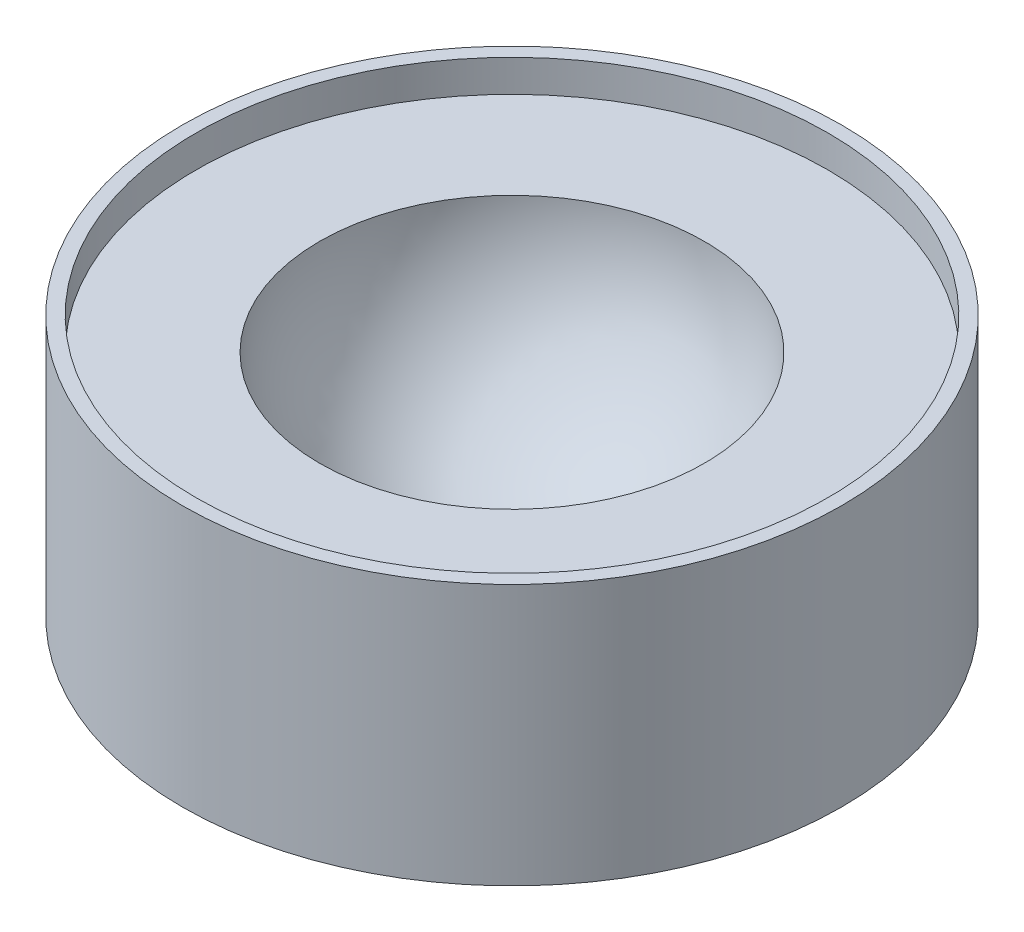
from build123d import *

# Parameters (mm, degrees)
SKETCH1_R           = 72
BOSS_EXTRUDE4_DEPTH = 50
SKETCH5_R           = 72
SKETCH5_R_2         = 69
BOSS_EXTRUDE5_DEPTH = 7


with BuildPart() as part:
    # Sketch1 → Boss-Extrude4 (new body)
    with BuildSketch(Plane(origin=(0, 0, 0), x_dir=(1, 0, 0), z_dir=(0, 1, 0))):
        with Locations(Location((0, 0, 0), (0, 0, 270))):
            Circle(SKETCH1_R)
    extrude(amount=BOSS_EXTRUDE4_DEPTH)

    # Sketch4 → Cut-Revolve2 (revolve, cut)
    with BuildSketch(Plane.XY, mode=Mode.PRIVATE) as cut_revolve2_sk:
        with BuildLine():
            Line((0, 50), (42, 50))
            ThreePointArc((42, 50), (29.69848481, 20.30151519), (0, 8))
            Line((0, 8), (0, 50))
        make_face()
    revolve(cut_revolve2_sk.sketch.rotate(Axis((0, 50, 0), (0, -1, 0)), 180), axis=Axis((0, 50, 0), (0, -1, 0)), mode=Mode.SUBTRACT)

    # Sketch5 → Boss-Extrude5 (add)
    with BuildSketch(Plane(origin=(0, 50, 0), x_dir=(1, 0, 0), z_dir=(0, 1, 0))):
        with Locations(Location((0, 0, 0), (0, 0, 270))):
            Circle(SKETCH5_R)
        with Locations(Location((0, 0, 0), (0, 0, 270))):
            Circle(SKETCH5_R_2, mode=Mode.SUBTRACT)
    extrude(amount=BOSS_EXTRUDE5_DEPTH)


solid = part.part
